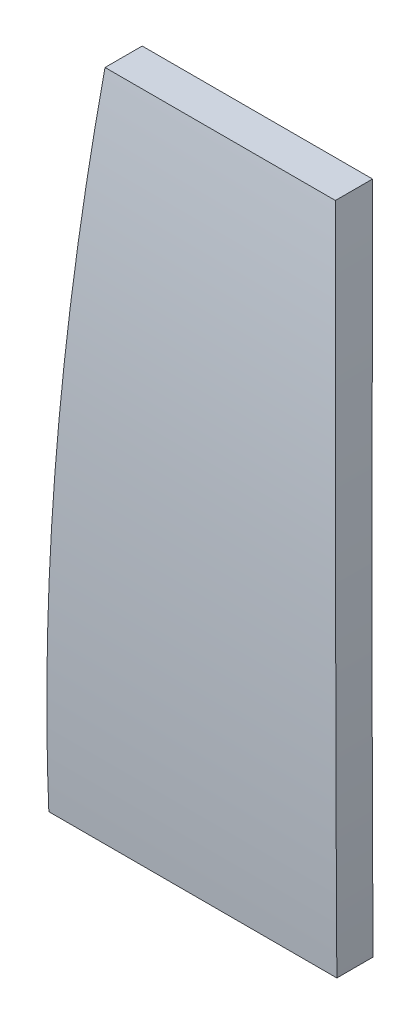
from build123d import *

# Parameters (mm, degrees)
BOSS_EXTRUDE1_DEPTH = 254
CUT_EXTRUDE1_DEPTH  = 1454.531751563


with BuildPart() as part:
    # Sketch1 → Boss-Extrude1 (new, symmetric)
    with BuildSketch(Plane.XY):
        with BuildLine():
            Line((0, 1295.4), (484.069392709, 1295.4))
            ThreePointArc((484.069392709, 1295.4), (586.375592164, 651.602339878), (605.253523509, 0))
            Line((605.253523509, 0), (0, 0))
            Line((0, 0), (0, 1295.4))
        make_face()
    extrude(amount=BOSS_EXTRUDE1_DEPTH, both=True)

    # Sketch2 → Cut-Extrude1 (cut, through all)
    with BuildSketch(Plane(origin=(0, 0, 0), x_dir=(0, 0, -1), z_dir=(1, 0, 0))):
        with BuildLine():
            add(Edge.make_bspline(
                [(118.0703125, 1295.4), (94.564776553, 1190.445048792), (74.284450362, 1084.766358232), (40.450619139, 871.89842811), (26.897056008, 764.709215485), (6.813653054, 548.75335337), (0.283725014, 439.986628438), (-3.289188409, 302.997080997), (-3.774237591, 275.547604227), (-4.153585947, 234.295160505), (-4.256202618, 213.649381304), (-4.227486533, 192.974099722), (-4.179073739, 179.184003972), (-4.140223283, 172.285212239), (-3.658962523, 110.213970933), (-2.295190534, 55.084572822), (0, 0)],
                knots=[0, 0, 0, 0, 0.25, 0.25, 0.5, 0.5, 0.75, 0.75, 0.8125, 0.8125, 0.84375, 0.859375, 0.859375, 0.875, 0.875, 1, 1, 1, 1], degree=3))
            Line((0, 0), (-254, 0))
            Line((-254, 0), (-254, 1295.4))
            Line((-254, 1295.4), (118.0703125, 1295.4))
        make_face()
        with BuildLine():
            add(Edge.make_bspline(
                [(76.26716522, 0), (75.100547551, 27.561733801), (73.705865568, 68.922796012), (72.702101108, 117.209761833), (72.405675036, 137.911126203), (72.23780187, 151.713581328), (72.168728413, 158.616910526), (71.681239412, 220.720840935), (72.201705183, 275.713845846), (76.560179878, 440.075482931), (83.194561022, 548.826861796), (103.595446179, 764.75559875), (117.362026574, 871.933032259), (151.723793203, 1084.78096463), (172.319025897, 1190.451438308), (196.186778864, 1295.4)],
                knots=[0, 0, 0, 0, 0.0625, 0.09375, 0.109375, 0.109375, 0.125, 0.125, 0.25, 0.25, 0.5, 0.5, 0.75, 0.75, 1, 1, 1, 1], degree=3))
            Line((196.186778864, 1295.4), (254, 1295.4))
            Line((254, 1295.4), (254, 0))
            Line((254, 0), (76.26716522, 0))
        make_face()
    extrude(amount=CUT_EXTRUDE1_DEPTH, mode=Mode.SUBTRACT)


solid = part.part
